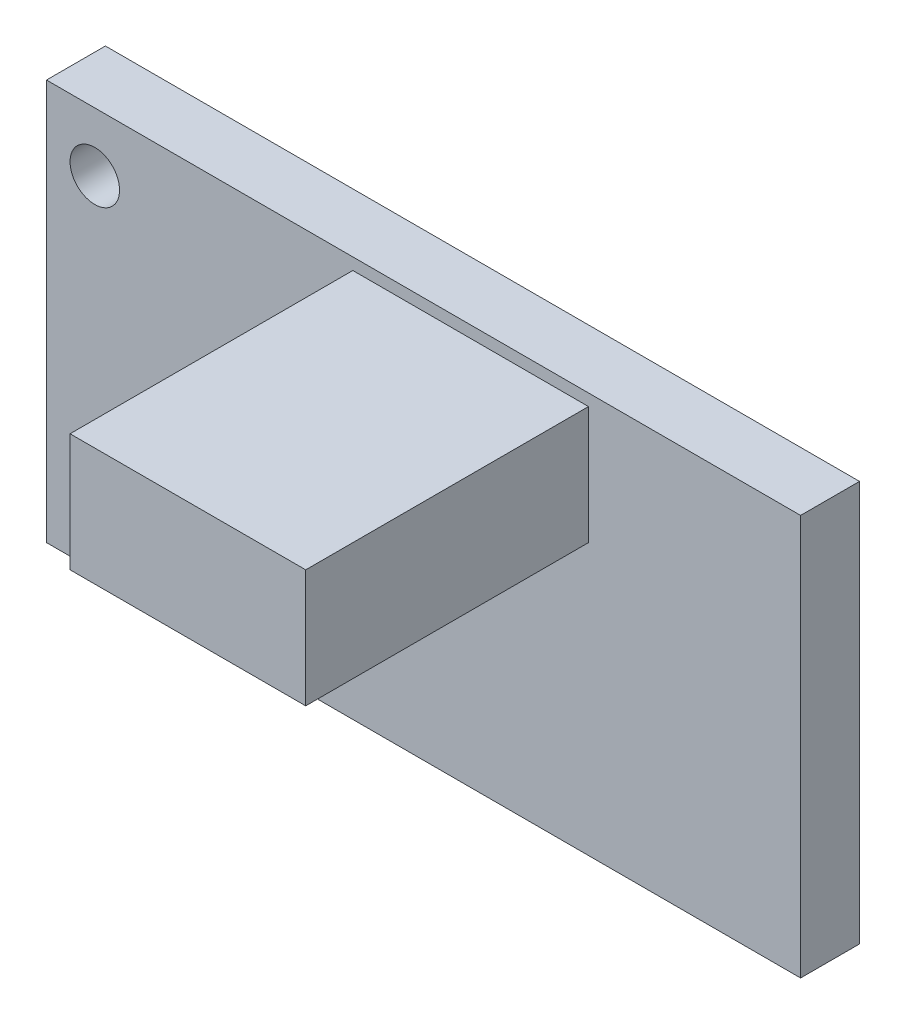
from build123d import *

# Parameters (mm, degrees)
SKETCH1_W           = 32
SKETCH1_H           = 17
BOSS_EXTRUDE1_DEPTH = 2.5
SKETCH2_W           = 10
SKETCH2_H           = 5
BOSS_EXTRUDE2_DEPTH = 12
SKETCH3_R           = 1.05
CUT_EXTRUDE1_DEPTH  = 12


with BuildPart() as part:
    # Sketch1 → Boss-Extrude1 (new body)
    with BuildSketch(Plane.XY):
        with Locations((16, -8.5)):
            Rectangle(SKETCH1_W, SKETCH1_H)
    extrude(amount=BOSS_EXTRUDE1_DEPTH)

    # Sketch2 → Boss-Extrude2 (add)
    with BuildSketch(Plane.XY.offset(2.5)):
        with Locations((18, -3)):
            Rectangle(SKETCH2_W, SKETCH2_H)
    extrude(amount=BOSS_EXTRUDE2_DEPTH)

    # Sketch3 → Cut-Extrude1 (cut)
    with BuildSketch(Plane.XY.offset(2.5)):
        with Locations((2.05, -2.5)):
            Circle(SKETCH3_R)
        with Locations((2.05, -14.5)):
            Circle(SKETCH3_R)
    extrude(amount=-CUT_EXTRUDE1_DEPTH, mode=Mode.SUBTRACT)


solid = part.part
